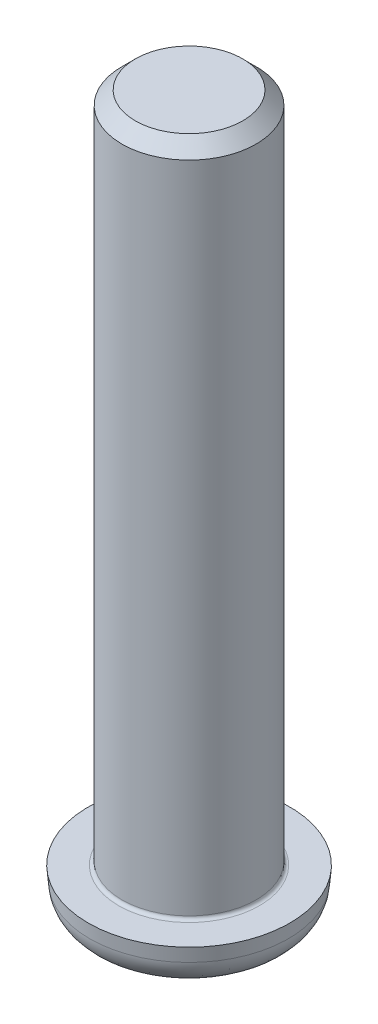
from build123d import *

# Parameters (mm, degrees)
FILLET5_R          = 0.2
CUT_EXTRUDE1_DEPTH = 1.27
CUT_EXTRUDE1_DRAFT = -3
FILLET4_R          = 0.05
CHAMFER1_SIZE      = 0.2


with BuildPart() as part:
    # Sketch1 → Revolve1 (revolve)
    with BuildSketch(Plane(origin=(0, 0, 0), x_dir=(0, 0, -1), z_dir=(1, 0, 0))):
        with BuildLine():
            Line((-1, 0), (-1, 10))
            Line((-1, 10), (0, 10))
            Line((0, 10), (0, -0.6))
            Line((0, -0.6), (-1.2, -0.6))
            ThreePointArc((-1.2, -0.6), (-1.394587635, -0.443831321), (-1.481627381, -0.21))
            Line((-1.481627381, -0.21), (-1.5, 0))
            Line((-1.5, 0), (-1, 0))
        make_face()
    revolve(axis=Axis((0, 10, 0), (0, -1, 0)))

    # Fillet5
    fillet5_edges = [part.edges().sort_by_distance(p)[0] for p in [
        (0, -0.6, -1.2),
    ]]
    fillet(fillet5_edges, radius=FILLET5_R)


with BuildPart() as cut_extrude1_tool:
    # Sketch2 → Cut-Extrude1 (with draft: the straight prism first)
    with BuildSketch(Plane.XZ.offset(0.6)):
        Polygon((0.15725, 0.15725), (0.15725, 0.925), (-0.15725, 0.925), (-0.15725, 0.15725), (-0.925, 0.15725), (-0.925, -0.15725), (-0.15725, -0.15725), (-0.15725, -0.925), (0.15725, -0.925), (0.15725, -0.15725), (0.925, -0.15725), (0.925, 0.15725), align=None)
    extrude(amount=-CUT_EXTRUDE1_DEPTH)
    # Cut-Extrude1: the draft: its side faces are tilted about the plane it starts from
    cut_extrude1_sides = [cut_extrude1_tool.faces().sort_by_distance(p)[0] for p in [
        (0.15725, 0.035, 0.541125),
        (0, 0.035, 0.925),
        (-0.15725, 0.035, 0.541125),
        (-0.541125, 0.035, 0.15725),
        (-0.925, 0.035, 0),
        (-0.541125, 0.035, -0.15725),
        (-0.15725, 0.035, -0.541125),
        (0, 0.035, -0.925),
        (0.15725, 0.035, -0.541125),
        (0.541125, 0.035, -0.15725),
        (0.925, 0.035, 0),
        (0.541125, 0.035, 0.15725),
    ]]
    draft(cut_extrude1_sides, Plane.XZ.offset(0.6), CUT_EXTRUDE1_DRAFT)


with BuildPart() as part_1:
    add(part.part)

    # Cut-Extrude1: cut by cut_extrude1_tool
    add(cut_extrude1_tool.part, mode=Mode.SUBTRACT)

    # Fillet4
    fillet4_edges = [part_1.edges().sort_by_distance(p)[0] for p in [
        (0, 0, -1),
    ]]
    fillet(fillet4_edges, radius=FILLET4_R)

    # Chamfer1
    chamfer1_edges = [part_1.edges().sort_by_distance(p)[0] for p in [
        (0, 10, -1),
    ]]
    chamfer(chamfer1_edges, length=CHAMFER1_SIZE)


solid = part_1.part
